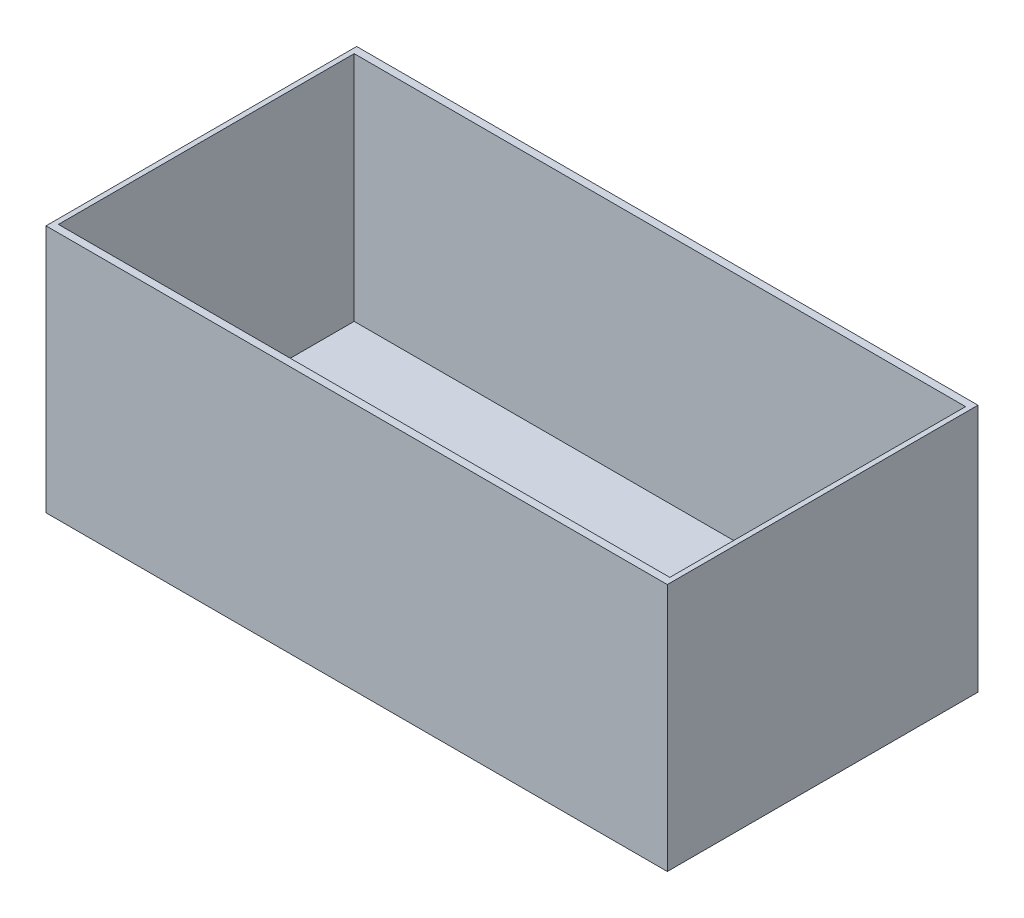
from build123d import *

# Parameters (mm, degrees)
SKETCH1_W           = 2500
SKETCH1_H           = 1250
BOSS_EXTRUDE1_DEPTH = 1000
SKETCH4_W           = 2460
SKETCH4_H           = 1190
CUT_EXTRUDE2_DEPTH  = 933


with BuildPart() as part:
    # Sketch1 → Boss-Extrude1 (new body)
    with BuildSketch(Plane(origin=(0, 0, 0), x_dir=(1, 0, 0), z_dir=(0, 1, 0))):
        with Locations((1137.887887888, -569.069069069)):
            Rectangle(SKETCH1_W, SKETCH1_H)
    extrude(amount=BOSS_EXTRUDE1_DEPTH)

    # Sketch4 → Cut-Extrude2 (cut)
    with BuildSketch(Plane(origin=(0, 1000, 0), x_dir=(1, 0, 0), z_dir=(0, 1, 0))):
        with Locations((1137.887887888, -569.069069069)):
            Rectangle(SKETCH4_W, SKETCH4_H)
    extrude(amount=-CUT_EXTRUDE2_DEPTH, mode=Mode.SUBTRACT)


solid = part.part
